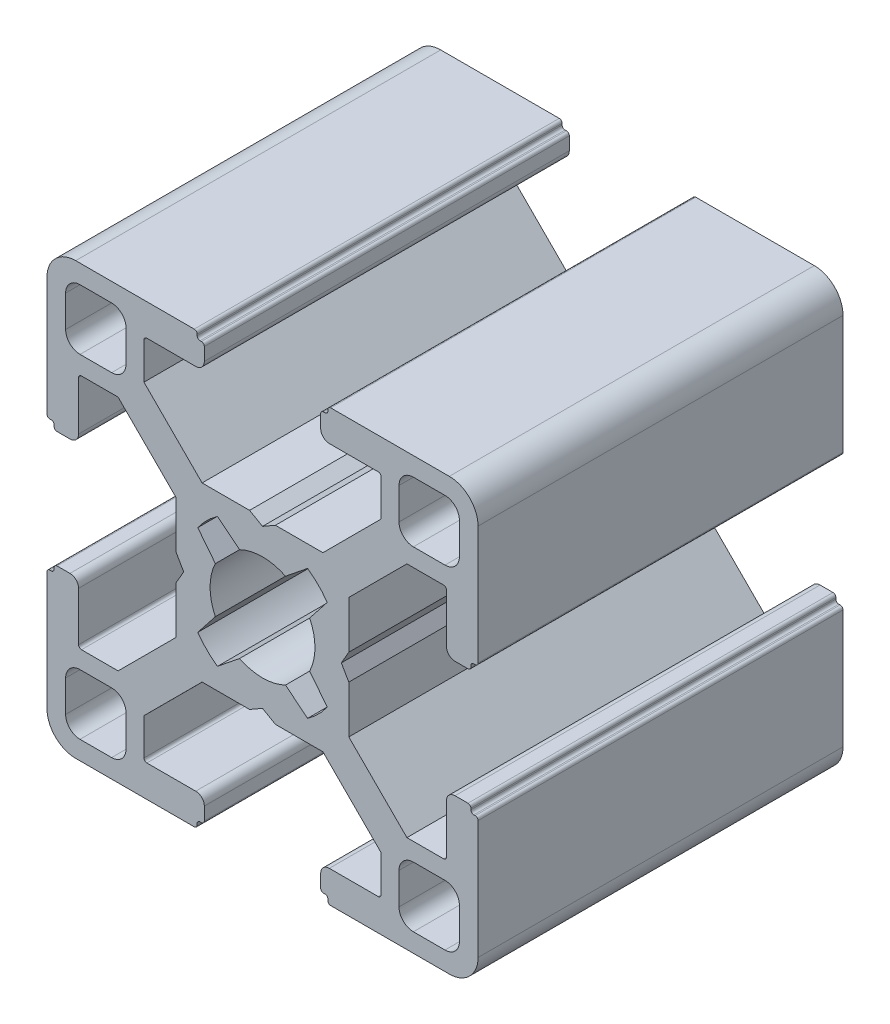
from build123d import *

# Parameters (mm, degrees)
BOSS_EXTRUDE1_DEPTH = 25.4


with BuildPart() as part:
    # Sketch1 → Boss-Extrude1 (new body)
    with BuildSketch(Plane.XY):
        with BuildLine():
            Line((6.00446543, 0.899999619), (5.484852164, 0))
            Line((5.484852164, 0), (6.00446543, -0.899999619))
            Line((6.00446543, -0.899999619), (6.00446543, -4.204465866))
            Line((6.00446543, -4.204465866), (10.049999564, -8.25))
            Line((10.049999564, -8.25), (12.59999928, -8.25))
            ThreePointArc((12.59999928, -8.25), (12.741420837, -8.191421273), (12.799999564, -8.049999716))
            Line((12.799999564, -8.049999716), (12.799999564, -4.649999613))
            ThreePointArc((12.799999564, -4.649999613), (12.975735606, -4.225735278), (13.39999994, -4.049999237))
            Line((13.39999994, -4.049999237), (14.300000043, -4.049999237))
            ThreePointArc((14.300000043, -4.049999237), (14.4414216, -4.108577964), (14.500000327, -4.249999521))
            Line((14.500000327, -4.249999521), (14.500000327, -4.349998953))
            ThreePointArc((14.500000327, -4.349998953), (14.558579054, -4.49142051), (14.700000611, -4.549999237))
            Line((14.700000611, -4.549999237), (14.799999716, -4.549999237))
            ThreePointArc((14.799999716, -4.549999237), (14.941421273, -4.608577964), (15, -4.749999521))
            Line((15, -4.749999521), (15, -13.000000346))
            ThreePointArc((15, -13.000000346), (14.414213664, -14.414213664), (13.000000346, -15))
            Line((13.000000346, -15), (4.749999945, -15))
            ThreePointArc((4.749999945, -15), (4.60857832, -14.941421245), (4.549999564, -14.799999619))
            Line((4.549999564, -14.799999619), (4.549999564, -14.69999942))
            ThreePointArc((4.549999564, -14.69999942), (4.49142109, -14.558578474), (4.350000144, -14.5))
            Line((4.350000144, -14.5), (4.250000374, -14.5))
            ThreePointArc((4.250000374, -14.5), (4.108578753, -14.441421247), (4.05, -14.299999626))
            Line((4.05, -14.299999626), (4.05, -13.399999434))
            ThreePointArc((4.05, -13.399999434), (4.225735989, -12.975735226), (4.650000197, -12.799999237))
            Line((4.650000197, -12.799999237), (8.049999924, -12.799999237))
            ThreePointArc((8.049999924, -12.799999237), (8.191421565, -12.741420475), (8.250000327, -12.599998834))
            Line((8.250000327, -12.599998834), (8.250000327, -10.049999237))
            Line((8.250000327, -10.049999237), (4.204466193, -6))
            Line((4.204466193, -6), (0.899999946, -6))
            Line((0.899999946, -6), (0, -5.484851837))
            Line((0, -5.484851837), (-0.899999946, -6))
            Line((-0.899999946, -6), (-4.204466193, -6))
            Line((-4.204466193, -6), (-8.250000327, -10.049999237))
            Line((-8.250000327, -10.049999237), (-8.250000327, -12.599998834))
            ThreePointArc((-8.250000327, -12.599998834), (-8.191421565, -12.741420475), (-8.049999924, -12.799999237))
            Line((-8.049999924, -12.799999237), (-4.650000197, -12.799999237))
            ThreePointArc((-4.650000197, -12.799999237), (-4.225735989, -12.975735226), (-4.05, -13.399999434))
            Line((-4.05, -13.399999434), (-4.05, -14.299999626))
            ThreePointArc((-4.05, -14.299999626), (-4.108578753, -14.441421247), (-4.250000374, -14.5))
            Line((-4.250000374, -14.5), (-4.350000144, -14.5))
            ThreePointArc((-4.350000144, -14.5), (-4.49142109, -14.558578474), (-4.549999564, -14.69999942))
            Line((-4.549999564, -14.69999942), (-4.549999564, -14.799999619))
            ThreePointArc((-4.549999564, -14.799999619), (-4.60857832, -14.941421245), (-4.749999945, -15))
            Line((-4.749999945, -15), (-13.000000346, -15))
            ThreePointArc((-13.000000346, -15), (-14.414213664, -14.414213664), (-15, -13.000000346))
            Line((-15, -13.000000346), (-15, -4.749999521))
            ThreePointArc((-15, -4.749999521), (-14.941421273, -4.608577964), (-14.799999716, -4.549999237))
            Line((-14.799999716, -4.549999237), (-14.700000611, -4.549999237))
            ThreePointArc((-14.700000611, -4.549999237), (-14.558579054, -4.49142051), (-14.500000327, -4.349998953))
            Line((-14.500000327, -4.349998953), (-14.500000327, -4.249999521))
            ThreePointArc((-14.500000327, -4.249999521), (-14.4414216, -4.108577964), (-14.300000043, -4.049999237))
            Line((-14.300000043, -4.049999237), (-13.39999994, -4.049999237))
            ThreePointArc((-13.39999994, -4.049999237), (-12.975735606, -4.225735278), (-12.799999564, -4.649999613))
            Line((-12.799999564, -4.649999613), (-12.799999564, -8.049999716))
            ThreePointArc((-12.799999564, -8.049999716), (-12.741420837, -8.191421273), (-12.59999928, -8.25))
            Line((-12.59999928, -8.25), (-10.049999564, -8.25))
            Line((-10.049999564, -8.25), (-6.00446543, -4.204465866))
            Line((-6.00446543, -4.204465866), (-6.00446543, -0.899999619))
            Line((-6.00446543, -0.899999619), (-5.484852164, 0))
            Line((-5.484852164, 0), (-6.00446543, 0.899999619))
            Line((-6.00446543, 0.899999619), (-6.00446543, 4.204465866))
            Line((-6.00446543, 4.204465866), (-10.049999564, 8.25))
            Line((-10.049999564, 8.25), (-12.59999928, 8.25))
            ThreePointArc((-12.59999928, 8.25), (-12.741420837, 8.191421273), (-12.799999564, 8.049999716))
            Line((-12.799999564, 8.049999716), (-12.799999564, 4.649999613))
            ThreePointArc((-12.799999564, 4.649999613), (-12.975735606, 4.225735278), (-13.39999994, 4.049999237))
            Line((-13.39999994, 4.049999237), (-14.300000043, 4.049999237))
            ThreePointArc((-14.300000043, 4.049999237), (-14.4414216, 4.108577964), (-14.500000327, 4.249999521))
            Line((-14.500000327, 4.249999521), (-14.500000327, 4.349998953))
            ThreePointArc((-14.500000327, 4.349998953), (-14.558579054, 4.49142051), (-14.700000611, 4.549999237))
            Line((-14.700000611, 4.549999237), (-14.799999716, 4.549999237))
            ThreePointArc((-14.799999716, 4.549999237), (-14.941421273, 4.608577964), (-15, 4.749999521))
            Line((-15, 4.749999521), (-15, 13.000000346))
            ThreePointArc((-15, 13.000000346), (-14.414213664, 14.414213664), (-13.000000346, 15))
            Line((-13.000000346, 15), (-4.749999945, 15))
            ThreePointArc((-4.749999945, 15), (-4.60857832, 14.941421245), (-4.549999564, 14.799999619))
            Line((-4.549999564, 14.799999619), (-4.549999564, 14.69999942))
            ThreePointArc((-4.549999564, 14.69999942), (-4.49142109, 14.558578474), (-4.350000144, 14.5))
            Line((-4.350000144, 14.5), (-4.250000374, 14.5))
            ThreePointArc((-4.250000374, 14.5), (-4.108578753, 14.441421247), (-4.05, 14.299999626))
            Line((-4.05, 14.299999626), (-4.05, 13.399999434))
            ThreePointArc((-4.05, 13.399999434), (-4.225735989, 12.975735226), (-4.650000197, 12.799999237))
            Line((-4.650000197, 12.799999237), (-8.049999924, 12.799999237))
            ThreePointArc((-8.049999924, 12.799999237), (-8.191421565, 12.741420475), (-8.250000327, 12.599998834))
            Line((-8.250000327, 12.599998834), (-8.250000327, 10.049999237))
            Line((-8.250000327, 10.049999237), (-4.204466193, 6))
            Line((-4.204466193, 6), (-0.899999946, 6))
            Line((-0.899999946, 6), (0, 5.484851837))
            Line((0, 5.484851837), (0.899999946, 6))
            Line((0.899999946, 6), (4.204466193, 6))
            Line((4.204466193, 6), (8.250000327, 10.049999237))
            Line((8.250000327, 10.049999237), (8.250000327, 12.599998834))
            ThreePointArc((8.250000327, 12.599998834), (8.191421565, 12.741420475), (8.049999924, 12.799999237))
            Line((8.049999924, 12.799999237), (4.650000197, 12.799999237))
            ThreePointArc((4.650000197, 12.799999237), (4.225735989, 12.975735226), (4.05, 13.399999434))
            Line((4.05, 13.399999434), (4.05, 14.299999626))
            ThreePointArc((4.05, 14.299999626), (4.108578753, 14.441421247), (4.250000374, 14.5))
            Line((4.250000374, 14.5), (4.350000144, 14.5))
            ThreePointArc((4.350000144, 14.5), (4.49142109, 14.558578474), (4.549999564, 14.69999942))
            Line((4.549999564, 14.69999942), (4.549999564, 14.799999619))
            ThreePointArc((4.549999564, 14.799999619), (4.60857832, 14.941421245), (4.749999945, 15))
            Line((4.749999945, 15), (13.000000346, 15))
            ThreePointArc((13.000000346, 15), (14.414213664, 14.414213664), (15, 13.000000346))
            Line((15, 13.000000346), (15, 4.749999521))
            ThreePointArc((15, 4.749999521), (14.941421273, 4.608577964), (14.799999716, 4.549999237))
            Line((14.799999716, 4.549999237), (14.700000611, 4.549999237))
            ThreePointArc((14.700000611, 4.549999237), (14.558579054, 4.49142051), (14.500000327, 4.349998953))
            Line((14.500000327, 4.349998953), (14.500000327, 4.249999521))
            ThreePointArc((14.500000327, 4.249999521), (14.4414216, 4.108577964), (14.300000043, 4.049999237))
            Line((14.300000043, 4.049999237), (13.39999994, 4.049999237))
            ThreePointArc((13.39999994, 4.049999237), (12.975735606, 4.225735278), (12.799999564, 4.649999613))
            Line((12.799999564, 4.649999613), (12.799999564, 8.049999716))
            ThreePointArc((12.799999564, 8.049999716), (12.741420837, 8.191421273), (12.59999928, 8.25))
            Line((12.59999928, 8.25), (10.049999564, 8.25))
            Line((10.049999564, 8.25), (6.00446543, 4.204465866))
            Line((6.00446543, 4.204465866), (6.00446543, 0.899999619))
        make_face()
        with BuildLine():
            Line((13.70000109, 12.700000398), (13.70000109, 10.499999635))
            ThreePointArc((13.70000109, 10.499999635), (13.407107874, 9.792892851), (12.70000109, 9.499999635))
            Line((12.70000109, 9.499999635), (10.500000327, 9.499999635))
            ThreePointArc((10.500000327, 9.499999635), (9.792893543, 9.792892851), (9.500000327, 10.499999635))
            Line((9.500000327, 10.499999635), (9.500000327, 12.700000398))
            ThreePointArc((9.500000327, 12.700000398), (9.792893543, 13.407107182), (10.500000327, 13.700000398))
            Line((10.500000327, 13.700000398), (12.70000109, 13.700000398))
            ThreePointArc((12.70000109, 13.700000398), (13.407107874, 13.407107182), (13.70000109, 12.700000398))
        make_face(mode=Mode.SUBTRACT)
        with BuildLine():
            Line((3.135929412, 4.518400903), (1.600129524, 3.280561767))
            ThreePointArc((1.600129524, 3.280561767), (0, 3.65), (-1.600129524, 3.280561767))
            Line((-1.600129524, 3.280561767), (-3.135929412, 4.518400903))
            ThreePointArc((-3.135929412, 4.518400903), (-3.881002259, 3.897155561), (-4.505336892, 3.154669473))
            Line((-4.505336892, 3.154669473), (-3.280561732, 1.600129597))
            ThreePointArc((-3.280561732, 1.600129597), (-3.65, 0), (-3.280561732, -1.600129597))
            Line((-3.280561732, -1.600129597), (-4.505336892, -3.154669473))
            ThreePointArc((-4.505336892, -3.154669473), (-3.881002259, -3.897155561), (-3.135929412, -4.518400903))
            Line((-3.135929412, -4.518400903), (-1.600129524, -3.280561767))
            ThreePointArc((-1.600129524, -3.280561767), (0, -3.65), (1.600129524, -3.280561767))
            Line((1.600129524, -3.280561767), (3.135929412, -4.518400903))
            ThreePointArc((3.135929412, -4.518400903), (3.881002259, -3.897155561), (4.505336892, -3.154669473))
            Line((4.505336892, -3.154669473), (3.280561732, -1.600129597))
            ThreePointArc((3.280561732, -1.600129597), (3.65, 0), (3.280561732, 1.600129597))
            Line((3.280561732, 1.600129597), (4.505336892, 3.154669473))
            ThreePointArc((4.505336892, 3.154669473), (3.881002259, 3.897155561), (3.135929412, 4.518400903))
        make_face(mode=Mode.SUBTRACT)
        with BuildLine():
            Line((-13.70000109, -12.700000398), (-13.70000109, -10.499999635))
            ThreePointArc((-13.70000109, -10.499999635), (-13.407107874, -9.792892851), (-12.70000109, -9.499999635))
            Line((-12.70000109, -9.499999635), (-10.500000327, -9.499999635))
            ThreePointArc((-10.500000327, -9.499999635), (-9.792893543, -9.792892851), (-9.500000327, -10.499999635))
            Line((-9.500000327, -10.499999635), (-9.500000327, -12.700000398))
            ThreePointArc((-9.500000327, -12.700000398), (-9.792893543, -13.407107182), (-10.500000327, -13.700000398))
            Line((-10.500000327, -13.700000398), (-12.70000109, -13.700000398))
            ThreePointArc((-12.70000109, -13.700000398), (-13.407107874, -13.407107182), (-13.70000109, -12.700000398))
        make_face(mode=Mode.SUBTRACT)
        with BuildLine():
            Line((10.500000327, -13.700000398), (12.70000109, -13.700000398))
            ThreePointArc((12.70000109, -13.700000398), (13.407107874, -13.407107182), (13.70000109, -12.700000398))
            Line((13.70000109, -12.700000398), (13.70000109, -10.499999635))
            ThreePointArc((13.70000109, -10.499999635), (13.407107874, -9.792892851), (12.70000109, -9.499999635))
            Line((12.70000109, -9.499999635), (10.500000327, -9.499999635))
            ThreePointArc((10.500000327, -9.499999635), (9.792893543, -9.792892851), (9.500000327, -10.499999635))
            Line((9.500000327, -10.499999635), (9.500000327, -12.700000398))
            ThreePointArc((9.500000327, -12.700000398), (9.792893543, -13.407107182), (10.500000327, -13.700000398))
        make_face(mode=Mode.SUBTRACT)
        with BuildLine():
            Line((-10.500000327, 13.700000398), (-12.70000109, 13.700000398))
            ThreePointArc((-12.70000109, 13.700000398), (-13.407107874, 13.407107182), (-13.70000109, 12.700000398))
            Line((-13.70000109, 12.700000398), (-13.70000109, 10.499999635))
            ThreePointArc((-13.70000109, 10.499999635), (-13.407107874, 9.792892851), (-12.70000109, 9.499999635))
            Line((-12.70000109, 9.499999635), (-10.500000327, 9.499999635))
            ThreePointArc((-10.500000327, 9.499999635), (-9.792893543, 9.792892851), (-9.500000327, 10.499999635))
            Line((-9.500000327, 10.499999635), (-9.500000327, 12.700000398))
            ThreePointArc((-9.500000327, 12.700000398), (-9.792893543, 13.407107182), (-10.500000327, 13.700000398))
        make_face(mode=Mode.SUBTRACT)
    extrude(amount=BOSS_EXTRUDE1_DEPTH)


solid = part.part
